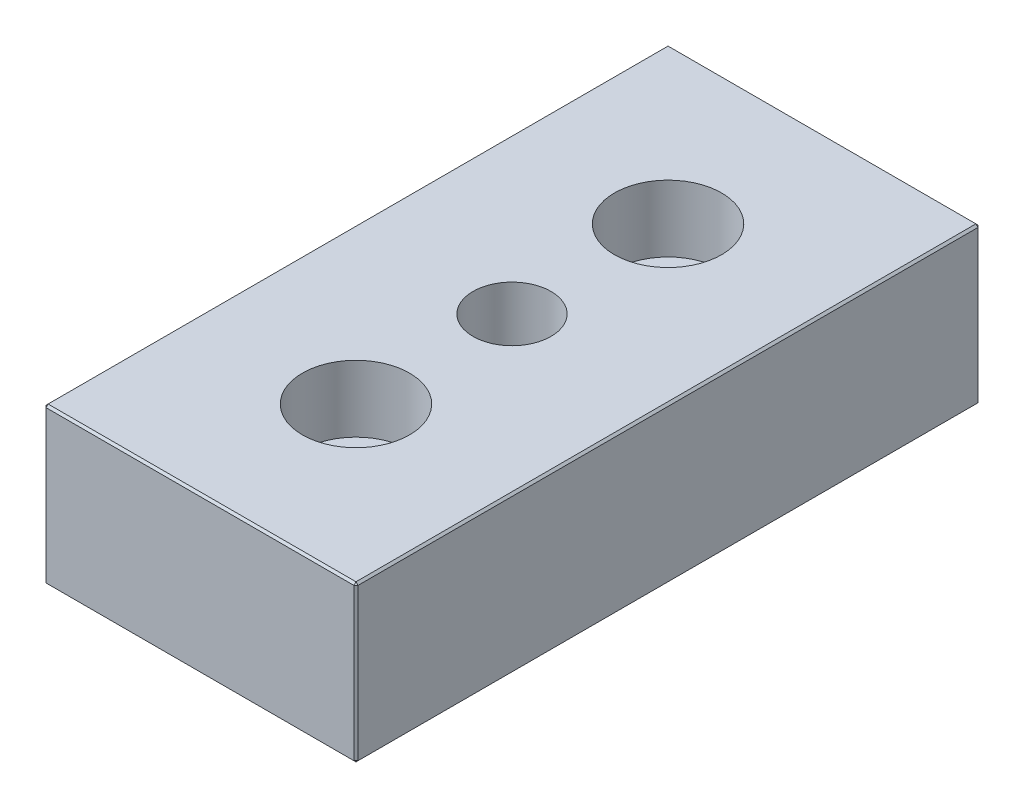
from build123d import *

# Parameters (mm, degrees)
SKETCH1_W          = 38.1
SKETCH1_H          = 76.2
SKETCH1_R          = 4.1656
SKETCH1_R_2        = 4.7625
EXTRUDE1_DEPTH     = 19.05
SKETCH2_R          = 6.5405
CUT_EXTRUDE1_DEPTH = 8.128
CHAMFER1_SIZE      = 0.254


with BuildPart() as part:
    # Sketch1 → Extrude1 (new body)
    with BuildSketch(Plane(origin=(0, 0, 0), x_dir=(1, 0, 0), z_dir=(0, 1, 0))):
        with Locations((-6.35, 38.1)):
            Rectangle(SKETCH1_W, SKETCH1_H)
        with Locations(Location((-6.35, 57.15, 0), (0, 0, 90))):
            Circle(SKETCH1_R, mode=Mode.SUBTRACT)
        with Locations(Location((-6.35, 19.05, 0), (0, 0, 90))):
            Circle(SKETCH1_R, mode=Mode.SUBTRACT)
        with Locations(Location((-6.35, 38.1, 0), (0, 0, 90))):
            Circle(SKETCH1_R_2, mode=Mode.SUBTRACT)
    extrude(amount=EXTRUDE1_DEPTH)

    # Sketch2 → Cut-Extrude1 (cut)
    with BuildSketch(Plane(origin=(0, 19.05, 0), x_dir=(1, 0, 0), z_dir=(0, 1, 0))):
        with Locations(Location((-6.35, 57.15, 0), (0, 0, 270))):
            Circle(SKETCH2_R)
        with Locations(Location((-6.35, 19.05, 0), (0, 0, 270))):
            Circle(SKETCH2_R)
    extrude(amount=-CUT_EXTRUDE1_DEPTH, mode=Mode.SUBTRACT)

    # Chamfer1
    chamfer1_edges = [part.edges().sort_by_distance(p)[0] for p in [
        (12.7, 19.05, -38.1),
        (-6.35, 19.05, -76.2),
        (-25.4, 19.05, -38.1),
        (-6.35, 0, -76.2),
        (12.7, 0, -38.1),
        (-6.35, 0, 0),
        (-25.4, 0, -38.1),
        (-6.35, 19.05, 0),
        (-25.4, 9.525, -76.2),
        (12.7, 9.525, -76.2),
        (12.7, 9.525, 0),
        (-25.4, 9.525, 0),
    ]]
    chamfer(chamfer1_edges, length=CHAMFER1_SIZE)


solid = part.part
